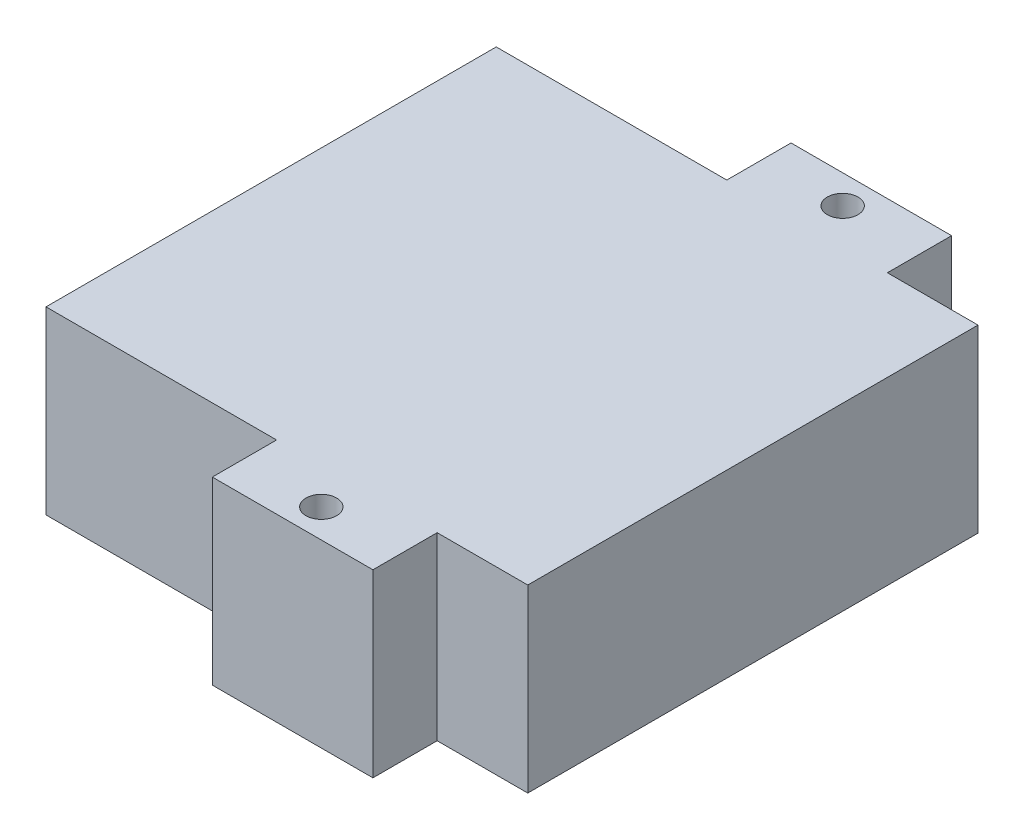
from build123d import *

# Parameters (mm, degrees)
BOSS_EXTRUDE1_DEPTH  = 19.9517
M3_CLEARANCE_HOLE1_D = 3.4


with BuildPart() as part:
    # Sketch1 → Boss-Extrude1 (new body)
    with BuildSketch(Plane(origin=(0, 0, 0), x_dir=(1, 0, 0), z_dir=(0, 1, 0))):
        Polygon((16.637, 24.92375), (26.67, 24.92375), (26.67, -24.92375), (16.637, -24.92375), (16.637, -32.03575), (-1.143, -32.03575), (-1.143, -24.92375), (-26.67, -24.92375), (-26.67, 24.92375), (-1.143, 24.92375), (-1.143, 32.03575), (16.637, 32.03575), align=None)
    extrude(amount=BOSS_EXTRUDE1_DEPTH)

    # M3 Clearance Hole1 (through all)
    with Locations(Plane(origin=(0, 19.9517, 0), x_dir=(1, 0, 0), z_dir=(0, 1, 0))):
        with Locations((7.747, 28.86075), (7.747, -28.86075)):
            Hole(M3_CLEARANCE_HOLE1_D / 2)


solid = part.part
